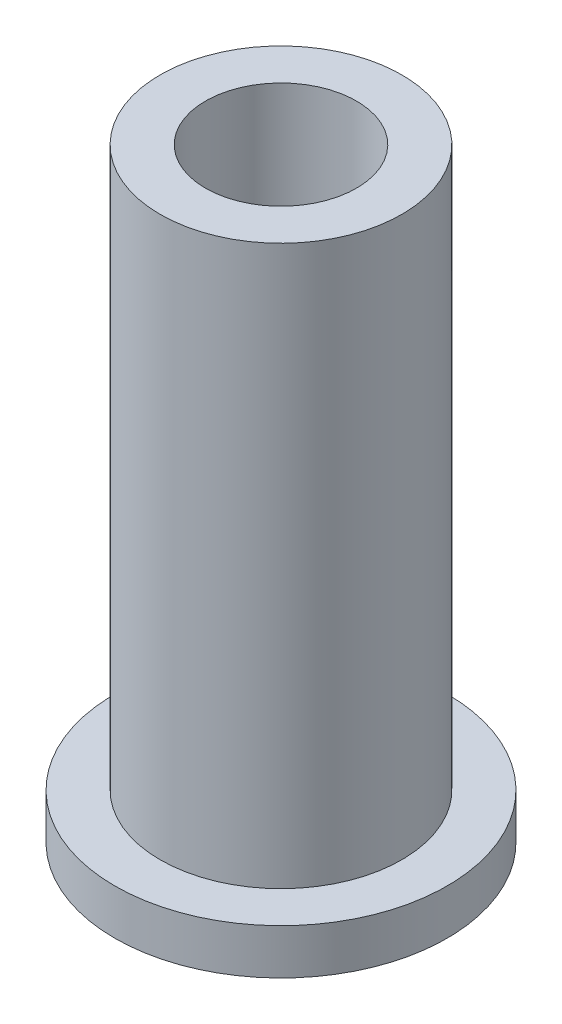
from build123d import *

# Parameters (mm, degrees)
SKETCH1_R           = 8
SKETCH1_R_2         = 5
BOSS_EXTRUDE2_DEPTH = 40
SKETCH4_R           = 11
SKETCH4_R_2         = 8
BOSS_EXTRUDE4_DEPTH = 3


with BuildPart() as part:
    # Sketch1 → Boss-Extrude2 (new body)
    with BuildSketch(Plane(origin=(0, 0, 0), x_dir=(1, 0, 0), z_dir=(0, 1, 0))):
        with Locations(Location((0, 0, 0), (0, 0, 270))):
            Circle(SKETCH1_R)
        with Locations(Location((0, 0, 0), (0, 0, 270))):
            Circle(SKETCH1_R_2, mode=Mode.SUBTRACT)
    extrude(amount=BOSS_EXTRUDE2_DEPTH)

    # Sketch4 → Boss-Extrude4 (add)
    with BuildSketch(Plane(origin=(0, 0, 0), x_dir=(1, 0, 0), z_dir=(0, 1, 0))):
        with Locations(Location((0, 0, 0), (0, 0, 270))):
            Circle(SKETCH4_R)
        with Locations(Location((0, 0, 0), (0, 0, 270))):
            Circle(SKETCH4_R_2, mode=Mode.SUBTRACT)
    extrude(amount=BOSS_EXTRUDE4_DEPTH)


solid = part.part
